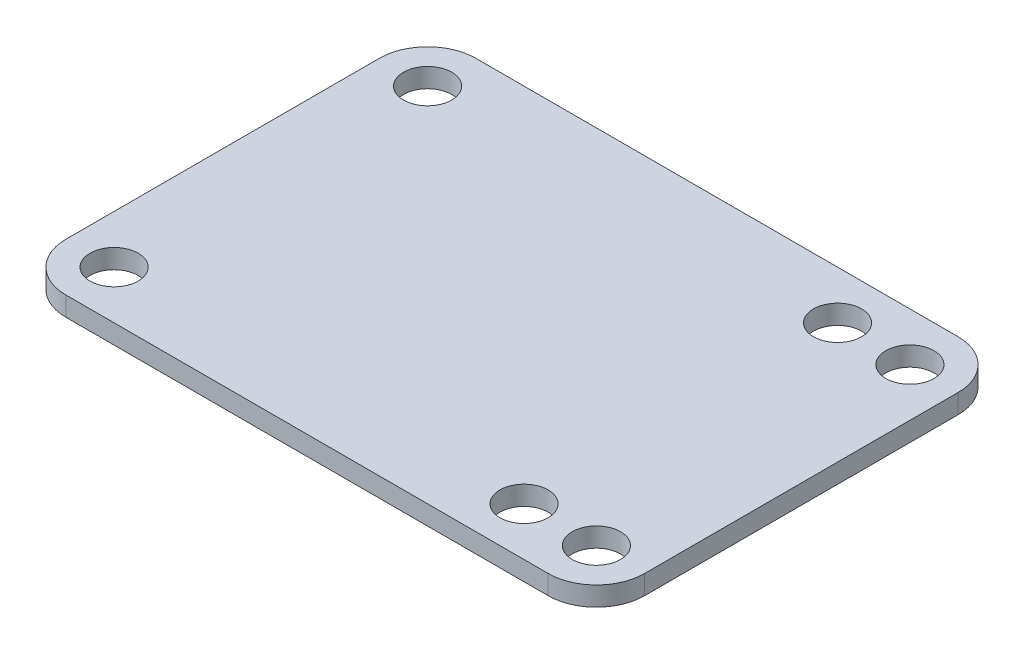
from build123d import *

# Parameters (mm, degrees)
MAIN_LID_SKETCH_W   = 76.2
MAIN_LID_SKETCH_H   = 53.975
MAIN_LID_DEPTH      = 2.54
HOLE_CUT_DEPTH      = 47.758814744
HOLE_CUT_DEPTH_BACK = 47.758814744
HOLE_CUT_SKETCH_R   = 3.175
CORNER_FILLET_R     = 6.35


with BuildPart() as part:
    # Main Lid Sketch → Main Lid (new body)
    with BuildSketch(Plane(origin=(0, 0, 0), x_dir=(1, 0, 0), z_dir=(0, 1, 0))):
        Rectangle(MAIN_LID_SKETCH_W, MAIN_LID_SKETCH_H)
    extrude(amount=MAIN_LID_DEPTH)

    # Hole Cut Sketch → Hole Cut (cut, two sides: drawn at the far end of the back side and taken through both)
    with BuildSketch(Plane(origin=(0, 2.54, 0), x_dir=(1, 0, 0), z_dir=(0, 1, 0)).offset(-HOLE_CUT_DEPTH_BACK)):
        with Locations(Location((31.75, -20.6375, 0), (0, 0, 270))):
            Circle(HOLE_CUT_SKETCH_R)
        with Locations(Location((22.225, -20.6375, 0), (0, 0, 270))):
            Circle(HOLE_CUT_SKETCH_R)
        with Locations(Location((-31.75, -20.6375, 0), (0, 0, 270))):
            Circle(HOLE_CUT_SKETCH_R)
        with Locations(Location((-31.75, 20.6375, 0), (0, 0, 270))):
            Circle(HOLE_CUT_SKETCH_R)
        with Locations(Location((22.225, 20.6375, 0), (0, 0, 270))):
            Circle(HOLE_CUT_SKETCH_R)
        with Locations(Location((31.75, 20.6375, 0), (0, 0, 270))):
            Circle(HOLE_CUT_SKETCH_R)
    extrude(amount=HOLE_CUT_DEPTH + HOLE_CUT_DEPTH_BACK, mode=Mode.SUBTRACT)

    # Corner Fillet
    corner_fillet_edges = [part.edges().sort_by_distance(p)[0] for p in [
        (-38.1, 1.27, -26.9875),
        (38.1, 1.27, -26.9875),
        (38.1, 1.27, 26.9875),
        (-38.1, 1.27, 26.9875),
    ]]
    fillet(corner_fillet_edges, radius=CORNER_FILLET_R)


solid = part.part
